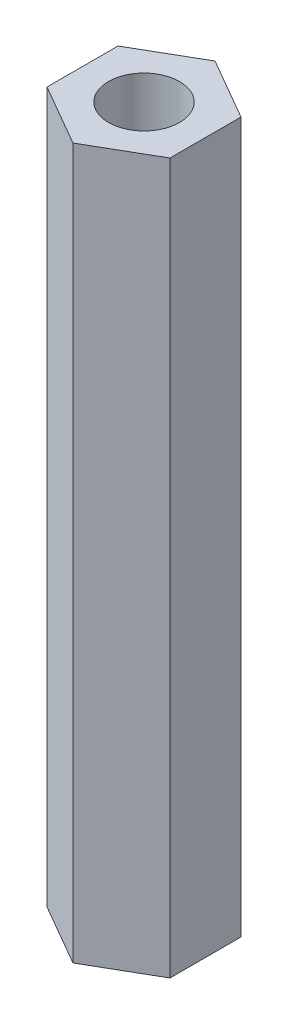
from build123d import *

# Parameters (mm, degrees)
SKETCH_1_R      = 1.5
EXTRUDE_1_DEPTH = 30


with BuildPart() as part:
    # Эскиз1 → Бобышка-Вытянуть1 (new body)
    with BuildSketch(Plane(origin=(0, 0, 0), x_dir=(1, 0, 0), z_dir=(0, 1, 0))):
        Polygon((-2.598076211, -1.5), (0, -3), (2.598076211, -1.5), (2.598076211, 1.5), (0, 3), (-2.598076211, 1.5), align=None)
        with Locations(Location((0, 0, 0), (0, 0, 270))):
            Circle(SKETCH_1_R, mode=Mode.SUBTRACT)
    extrude(amount=EXTRUDE_1_DEPTH)


solid = part.part
